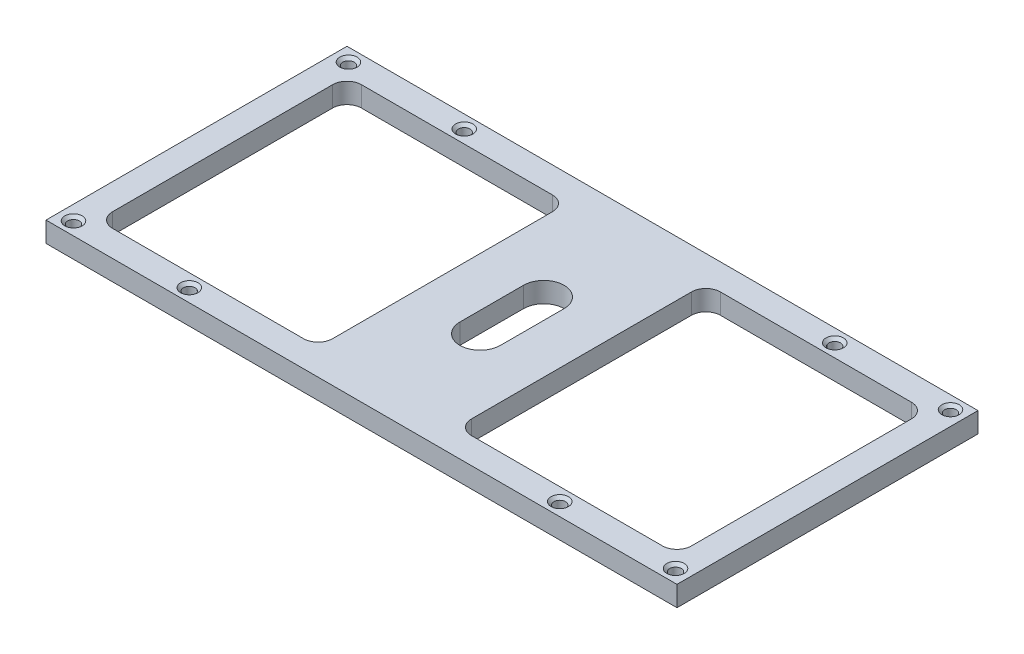
from build123d import *

# Parameters (mm, degrees)
BOSS_EXTRUDE1_DEPTH = 7
FILLET1_R           = 5
SKETCH2_R           = 2
CUT_EXTRUDE1_DEPTH  = 121.971070922
SKETCH3_R           = 3.75
CUT_EXTRUDE2_DEPTH  = 3
CHAMFER1_SIZE       = 1


with BuildPart() as part:
    # Sketch1 → Boss-Extrude1 (new body)
    with BuildSketch(Plane(origin=(0, 0, 0), x_dir=(1, 0, 0), z_dir=(0, 1, 0))):
        with BuildLine():
            Line((0, 0), (109, 0))
            Line((109, 0), (109, 34))
            ThreePointArc((109, 34), (104.050252532, 36.050252532), (102, 41))
            Line((102, 41), (102, 52))
            Line((102, 52), (85, 52))
            Line((85, 52), (85, 9))
            Line((85, 9), (9, 9))
            Line((9, 9), (9, 52))
            Line((9, 52), (0, 52))
            Line((0, 52), (0, 0))
        make_face()
    extrude(amount=BOSS_EXTRUDE1_DEPTH)

    # Fillet1
    fillet1_edges = [part.edges().sort_by_distance(p)[0] for p in [
        (9, 3.5, -9),
        (85, 3.5, -9),
    ]]
    fillet(fillet1_edges, radius=FILLET1_R)

    # Sketch2 → Cut-Extrude1 (cut, through all)
    with BuildSketch(Plane(origin=(0, 7, 0), x_dir=(1, 0, 0), z_dir=(0, 1, 0))):
        with Locations(Location((5, 4.5, 0), (0, 0, 270))):
            Circle(SKETCH2_R)
        with Locations(Location((45, 4.5, 0), (0, 0, 270))):
            Circle(SKETCH2_R)
    extrude(amount=-CUT_EXTRUDE1_DEPTH, mode=Mode.SUBTRACT)

    # Sketch3 → Cut-Extrude2 (cut)
    with BuildSketch(Plane(origin=(0, 0, 0), x_dir=(-1, 0, 0), z_dir=(0, -1, 0))):
        with Locations((-109, 4.5)):
            Circle(SKETCH3_R)
    extrude(amount=-CUT_EXTRUDE2_DEPTH, mode=Mode.SUBTRACT)

    # Chamfer1
    chamfer1_edges = [part.edges().sort_by_distance(p)[0] for p in [
        (5, 7, -6.5),
        (45, 7, -6.5),
    ]]
    chamfer(chamfer1_edges, length=CHAMFER1_SIZE)

    # Mirror1: part across plane


with BuildPart() as part_1:
    add(part.part)
    add(part.part.mirror(Plane(origin=(9, 7, -52), x_dir=(1, 0, 0), z_dir=(0, 0, 1))))

    # Mirror2: part across plane


with BuildPart() as part_2:
    add(part_1.part)
    add(part_1.part.mirror(Plane(origin=(109, 7, -104), x_dir=(0, 0, 1), z_dir=(-1, 0, 0))))


solid = part_2.part
